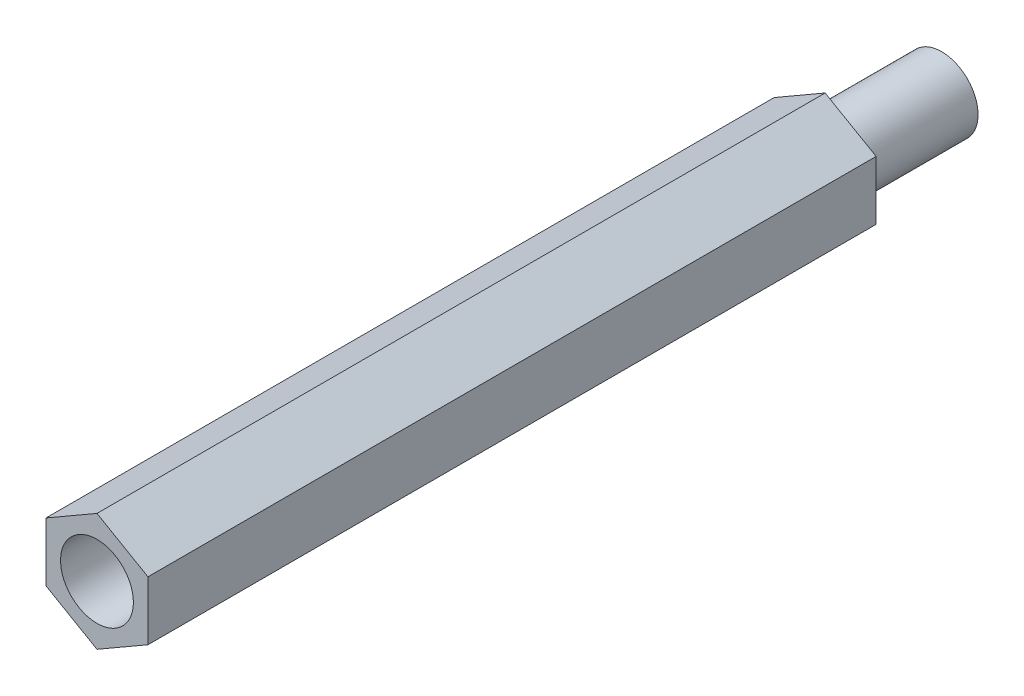
from build123d import *

# Parameters (mm, degrees)
EXTRUDE_1_DEPTH     = 60
SKETCH_2_R          = 2.5
EXTRUDE_2_DEPTH     = 8
SKETCH_3_R          = 2.5
CUT_EXTRUDE_1_DEPTH = 50
SKETCH_4_R          = 11.437088518
CUT_EXTRUDE_2_DEPTH = 20
EXTRUDE_3_DEPTH     = 5
SKETCH_6_R          = 2.5
CUT_EXTRUDE_3_DEPTH = 16
EXTRUDE_5_DEPTH     = 5
SKETCH_9_R          = 2.5
CUT_EXTRUDE_4_DEPTH = 5


with BuildPart() as part:
    # 草图1 → 凸台-拉伸1 (new body)
    with BuildSketch(Plane.XY):
        Polygon((3.5, -2.020725942), (3.5, 2.020725942), (0, 4.041451884), (-3.5, 2.020725942), (-3.5, -2.020725942), (0, -4.041451884), align=None)
    extrude(amount=EXTRUDE_1_DEPTH)

    # 草图2 → 凸台-拉伸2 (add)
    with BuildSketch(Plane(origin=(0, 0, 0), x_dir=(-1, 0, 0), z_dir=(0, 0, -1))):
        Circle(SKETCH_2_R)
    extrude(amount=EXTRUDE_2_DEPTH)

    # 草图3 → 切除-拉伸1 (cut)
    with BuildSketch(Plane.XY.offset(60)):
        with Locations(Location((0, 0, 0), (0, 0, 180))):
            Circle(SKETCH_3_R)
    extrude(amount=-CUT_EXTRUDE_1_DEPTH, mode=Mode.SUBTRACT)

    # 草图4 → 切除-拉伸2 (cut)
    with BuildSketch(Plane.XY.offset(60)):
        with Locations((-0.3770193, 0.287149771)):
            Circle(SKETCH_4_R)
    extrude(amount=-CUT_EXTRUDE_2_DEPTH, mode=Mode.SUBTRACT)

    # 草图5 → 凸台-拉伸3 (add)
    with BuildSketch(Plane.XY.offset(40)):
        Polygon((0, 4.041451884), (-3.5, 2.020725942), (-3.5, -2.020725942), (0, -4.041451884), (3.5, -2.020725942), (3.5, 2.020725942), align=None)
    extrude(amount=EXTRUDE_3_DEPTH)

    # 草图6 → 切除-拉伸3 (cut)
    with BuildSketch(Plane.XY.offset(45)):
        Circle(SKETCH_6_R)
    extrude(amount=-CUT_EXTRUDE_3_DEPTH, mode=Mode.SUBTRACT)

    # 草图7 → 凸台-拉伸5 (add)
    with BuildSketch(Plane.XY.offset(45)):
        Polygon((-3.5, 2.020725942), (0, 4.041451884), (3.5, 2.020725942), (3.5, -2.020725942), (0, -4.041451884), (-3.5, -2.020725942), align=None)
    extrude(amount=EXTRUDE_5_DEPTH)

    # 草图9 → 切除-拉伸4 (cut)
    with BuildSketch(Plane.XY.offset(50)):
        with Locations(Location((0, 0, 0), (0, 0, 180))):
            Circle(SKETCH_9_R)
    extrude(amount=-CUT_EXTRUDE_4_DEPTH, mode=Mode.SUBTRACT)


solid = part.part
